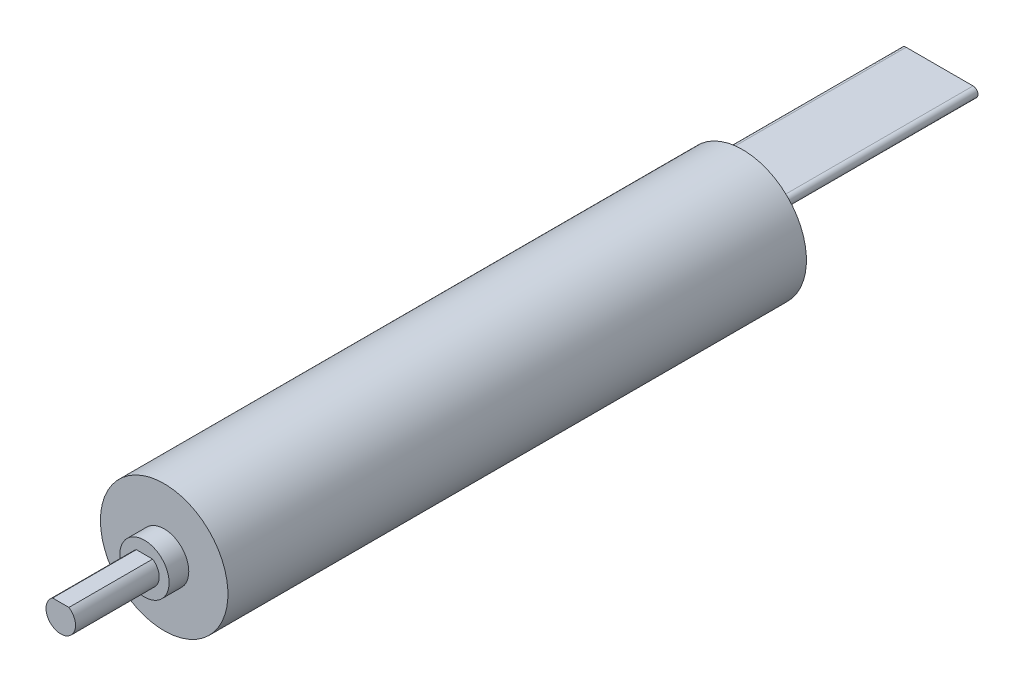
from build123d import *

# Parameters (mm, degrees)
SKETCH1_R           = 6.475
BOSS_EXTRUDE1_DEPTH = 58.75
SKETCH2_R           = 2.5
BOSS_EXTRUDE2_DEPTH = 2
BOSS_EXTRUDE3_DEPTH = 8.5
BOSS_EXTRUDE4_DEPTH = 20


with BuildPart() as part:
    # Sketch1 → Boss-Extrude1 (new body)
    with BuildSketch(Plane.XY):
        with Locations(Location((0, 0, 0), (0, 0, 180))):
            Circle(SKETCH1_R)
    extrude(amount=BOSS_EXTRUDE1_DEPTH)

    # Sketch2 → Boss-Extrude2 (add)
    with BuildSketch(Plane.XY.offset(58.75)):
        Circle(SKETCH2_R)
    extrude(amount=BOSS_EXTRUDE2_DEPTH)

    # Sketch3 → Boss-Extrude3 (add)
    with BuildSketch(Plane.XY.offset(60.75)):
        with BuildLine():
            Line((0, 1.25), (-0.829156198, 1.25))
            ThreePointArc((-0.829156198, 1.25), (-1.436140662, -0.433012702), (0, -1.5))
            Line((0, -1.5), (0, 1.25))
        make_face()
        with BuildLine():
            Line((0.829156198, 1.25), (0, 1.25))
            Line((0, 1.25), (0, -1.5))
            ThreePointArc((0, -1.5), (1.060660172, -1.060660172), (1.5, 0))
            ThreePointArc((1.5, 0), (1.321691018, 0.709318583), (0.829156198, 1.25))
        make_face()
    extrude(amount=BOSS_EXTRUDE3_DEPTH)

    # Sketch4 → Boss-Extrude4 (add)
    with BuildSketch(Plane(origin=(0, 0, 0), x_dir=(-1, 0, 0), z_dir=(0, 0, -1))):
        with BuildLine():
            Line((-3.4, 3.775), (3.4, 3.775))
            ThreePointArc((3.4, 3.775), (3.9, 3.275), (3.4, 2.775))
            Line((3.4, 2.775), (-3.4, 2.775))
            ThreePointArc((-3.4, 2.775), (-3.9, 3.275), (-3.4, 3.775))
        make_face()
    extrude(amount=BOSS_EXTRUDE4_DEPTH)


solid = part.part
